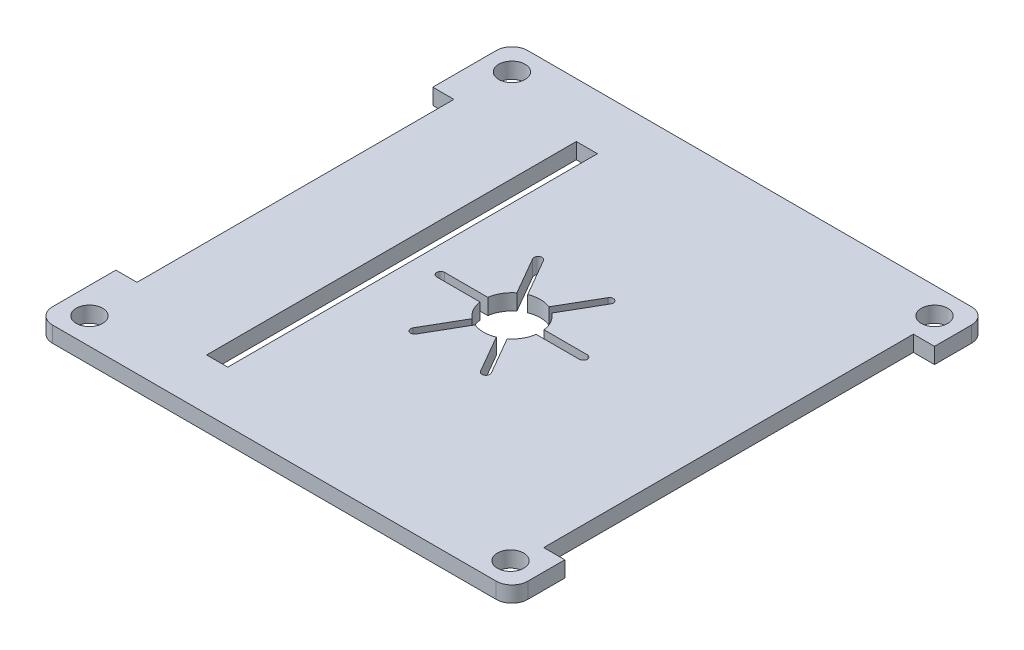
from build123d import *

# Parameters (mm, degrees)
SKETCH1_W           = 4
SKETCH1_H           = 70
SKETCH1_H_2         = 60
BOSS_EXTRUDE1_DEPTH = 3
SKETCH1_3_W         = 4
SKETCH1_3_H         = 60
SKETCH1_3_H_2       = 70
BOSS_EXTRUDE2_DEPTH = 70
SKETCH1_4_W         = 4
SKETCH1_4_H         = 70
BOSS_EXTRUDE3_DEPTH = 70
SKETCH5_R           = 4
CUT_EXTRUDE4_DEPTH  = 10
SKETCH6_R           = 2.5
CUT_EXTRUDE5_DEPTH  = 10
SKETCH1_5_W         = 4
SKETCH1_5_H         = 60
BOSS_EXTRUDE4_DEPTH = 80
SKETCH5_2_R         = 4
CUT_EXTRUDE6_DEPTH  = 10
FILLET1_R           = 3
FILLET2_R           = 5
FILLET3_R           = 4
SKETCH7_R           = 2.5
CUT_EXTRUDE7_DEPTH  = 10
SKETCH8_R           = 2.5
CUT_EXTRUDE8_DEPTH  = 10
CUT_EXTRUDE9_REACH  = 132.084
SKETCH9_R           = 3.5
SKETCH26_R          = 2.5
CUT_EXTRUDE11_DEPTH = 10
CUT_EXTRUDE14_DEPTH = 10
CUT_EXTRUDE15_DEPTH = 10
SKETCH28_R          = 1
SKETCH28_R_2        = 4
CUT_EXTRUDE16_DEPTH = 4
SKETCH29_R          = 1
SKETCH29_R_2        = 3.5
CUT_EXTRUDE18_DEPTH = 4
SKETCH31_R          = 5.375
CUT_EXTRUDE19_DEPTH = 10
SKETCH32_W          = 71.641660037
SKETCH32_H          = 79.51751689
CUT_EXTRUDE20_DEPTH = 131.084107183
SKETCH33_W          = 4
SKETCH33_H          = 70
SKETCH33_H_2        = 60
CUT_EXTRUDE21_DEPTH = 71.771465692


with BuildPart() as part:
    # Sketch1 → Boss-Extrude1 (new body)
    # profile 1 of 4: a face of its own
    with BuildSketch(Plane(origin=(0, 0, 0), x_dir=(1, 0, 0), z_dir=(0, 1, 0))):
        Polygon((-50.771305032, 49.212548619), (-50.771305032, 34.212548619), (-46.771305032, 34.212548619), (-46.771305032, -25.787451381), (-50.771305032, -25.787451381), (-50.771305032, -40.787451381), (39.228694968, -40.787451381), (39.228694968, -30.787451381), (35.228694968, -30.787451381), (35.228694968, 39.212548619), (39.228694968, 39.212548619), (39.228694968, 49.212548619), align=None)
        with Locations((-26.271305032, 3.893815937)):
            Rectangle(SKETCH1_W, SKETCH1_H, mode=Mode.SUBTRACT)
    # profile 2 of 4: a face of its own
    with BuildSketch(Plane(origin=(0, 0, 0), x_dir=(1, 0, 0), z_dir=(0, 1, 0))):
        with Locations((37.228694968, 4.212548619)):
            Rectangle(SKETCH1_W, SKETCH1_H)
    # profile 3 of 4: a face of its own
    with BuildSketch(Plane(origin=(0, 0, 0), x_dir=(1, 0, 0), z_dir=(0, 1, 0))):
        with Locations((-48.771305032, 4.212548619)):
            Rectangle(SKETCH1_W, SKETCH1_H_2)
    # profile 4 of 4: a face of its own
    with BuildSketch(Plane(origin=(0, 0, 0), x_dir=(1, 0, 0), z_dir=(0, 1, 0))):
        with Locations((-26.271305032, 3.893815937)):
            Rectangle(SKETCH1_W, SKETCH1_H)
    extrude(amount=BOSS_EXTRUDE1_DEPTH)

    # Sketch1<3> → Boss-Extrude2 (add)
    with BuildSketch(Plane(origin=(0, 0, 0), x_dir=(1, 0, 0), z_dir=(0, 1, 0))):
        with Locations((-48.771305032, 4.212548619)):
            Rectangle(SKETCH1_3_W, SKETCH1_3_H)
        with Locations((37.228694968, 4.212548619)):
            Rectangle(SKETCH1_3_W, SKETCH1_3_H_2)
    extrude(amount=BOSS_EXTRUDE2_DEPTH)

    # Sketch1<4> → Boss-Extrude3 (add)
    with BuildSketch(Plane(origin=(0, 0, 0), x_dir=(1, 0, 0), z_dir=(0, 1, 0))):
        with Locations((-26.271305032, 3.893815937)):
            Rectangle(SKETCH1_4_W, SKETCH1_4_H)
    extrude(amount=BOSS_EXTRUDE3_DEPTH)

    # Sketch5 → Cut-Extrude4 (cut)
    with BuildSketch(Plane.ZY.offset(50.771305032)):
        with Locations((-8.022548619, 60)):
            Circle(SKETCH5_R)
    extrude(amount=-CUT_EXTRUDE4_DEPTH, mode=Mode.SUBTRACT)

    # Sketch6 → Cut-Extrude5 (cut)
    with BuildSketch(Plane(origin=(0, 3, 0), x_dir=(1, 0, 0), z_dir=(0, 1, 0))):
        with Locations(Location((-45.787574368, -35.787451381, 0), (0, 0, 270))):
            Circle(SKETCH6_R)
        with Locations(Location((-45.787574368, 44.212548619, 0), (0, 0, 270))):
            Circle(SKETCH6_R)
        with Locations((43.718511914, 44.212548619)):
            Circle(SKETCH6_R)
        with Locations((43.718511914, -35.787451381)):
            Circle(SKETCH6_R)
    extrude(amount=-CUT_EXTRUDE5_DEPTH, mode=Mode.SUBTRACT)

    # Sketch1<5> → Boss-Extrude4 (add)
    with BuildSketch(Plane(origin=(0, 0, 0), x_dir=(1, 0, 0), z_dir=(0, 1, 0))):
        with Locations((-48.771305032, 4.212548619)):
            Rectangle(SKETCH1_5_W, SKETCH1_5_H)
    extrude(amount=BOSS_EXTRUDE4_DEPTH)

    # Sketch5<2> → Cut-Extrude6 (cut)
    with BuildSketch(Plane.ZY.offset(50.771305032)):
        with Locations((-8.022548619, 60)):
            Circle(SKETCH5_2_R)
    extrude(amount=-CUT_EXTRUDE6_DEPTH, mode=Mode.SUBTRACT)

    # Fillet1
    fillet1_edges = [part.edges().sort_by_distance(p)[0] for p in [
        (-50.771305032, 1.5, 40.787451381),
        (-50.771305032, 1.5, -49.212548619),
        (39.228694968, 1.5, -49.212548619),
        (39.228694968, 1.5, 40.787451381),
    ]]
    fillet(fillet1_edges, radius=FILLET1_R)

    # Fillet2
    fillet2_edges = [part.edges().sort_by_distance(p)[0] for p in [
        (-48.771305032, 80, -34.212548619),
        (-48.771305032, 80, 25.787451381),
        (37.228694968, 70, -39.212548619),
        (37.228694968, 70, 30.787451381),
    ]]
    fillet(fillet2_edges, radius=FILLET2_R)

    # Fillet3
    fillet3_edges = [part.edges().sort_by_distance(p)[0] for p in [
        (-26.271305032, 70, 31.106184063),
        (-26.271305032, 70, -38.893815937),
    ]]
    fillet(fillet3_edges, radius=FILLET3_R)

    # Sketch7 → Cut-Extrude7 (cut)
    with BuildSketch(Plane(origin=(39.228694968, 0, 0), x_dir=(0, 0, -1), z_dir=(1, 0, 0))):
        with Locations((27.482306935, -10)):
            Circle(SKETCH7_R)
    extrude(amount=-CUT_EXTRUDE7_DEPTH, mode=Mode.SUBTRACT)

    # Sketch8 → Cut-Extrude8 (cut)
    with BuildSketch(Plane(origin=(39.228694968, 0, 0), x_dir=(0, 0, -1), z_dir=(1, 0, 0))):
        with Locations((8.02072759, 38.893893193)):
            Circle(SKETCH8_R)
    extrude(amount=-CUT_EXTRUDE8_DEPTH, mode=Mode.SUBTRACT)

    # Cut-Extrude9: up to this face of the body (flat: up to its plane)
    cut_extrude9_end = Plane(part.part.faces().sort_by_distance((-28.271305032, 36.452186393, -3.893815937))[0])
    # Sketch9 → Cut-Extrude9 (cut, up to the picked face)
    with BuildSketch(Plane(origin=(39.228694968, 0, 0), x_dir=(0, 0, -1), z_dir=(1, 0, 0)), mode=Mode.PRIVATE) as cut_extrude9_sk1:
        with Locations((8.02072759, 38.893893193)):
            Circle(SKETCH9_R)
    cut_extrude9_tool1 = split(extrude(cut_extrude9_sk1.sketch, amount=-CUT_EXTRUDE9_REACH, mode=Mode.PRIVATE), bisect_by=cut_extrude9_end, keep=Keep.BOTH, mode=Mode.PRIVATE)
    add(cut_extrude9_tool1.solids().sort_by(Axis((39.228695, 38.893893, -8.020728), (-1, 0, 0)))[0], mode=Mode.SUBTRACT)

    # Sketch26 → Cut-Extrude11 (cut)
    with BuildSketch(Plane(origin=(0, 3, 0), x_dir=(1, 0, 0), z_dir=(0, 1, 0))):
        with Locations(Location((34.228694968, -36.063353705, 0), (0, 0, 270))):
            Circle(SKETCH26_R)
        with Locations(Location((34.228694968, 44.212548619, 0), (0, 0, 270))):
            Circle(SKETCH26_R)
    extrude(amount=-CUT_EXTRUDE11_DEPTH, mode=Mode.SUBTRACT)

    # Sketch27 → Cut-Extrude14 (cut)
    with BuildSketch(Plane(origin=(0, 3, 0), x_dir=(1, 0, 0), z_dir=(0, 1, 0))):
        with BuildLine():
            Line((7.728694968, 3.462548619), (-19.271305032, 3.462548619))
            ThreePointArc((-19.271305032, 3.462548619), (-20.021305032, 4.212548619), (-19.271305032, 4.962548619))
            Line((-19.271305032, 4.962548619), (7.728694968, 4.962548619))
            ThreePointArc((7.728694968, 4.962548619), (8.478694968, 4.212548619), (7.728694968, 3.462548619))
        make_face()
        with BuildLine():
            Line((0.329175915, -7.853794332), (-13.170824085, 15.52889157))
            ThreePointArc((-13.170824085, 15.52889157), (-12.896305032, 16.553410623), (-11.871785979, 16.27889157))
            Line((-11.871785979, 16.27889157), (1.628214021, -7.103794332))
            ThreePointArc((1.628214021, -7.103794332), (1.353694968, -8.128313385), (0.329175915, -7.853794332))
        make_face()
        with BuildLine():
            Line((-13.170824085, -7.103794332), (0.329175915, 16.27889157))
            ThreePointArc((0.329175915, 16.27889157), (1.353694968, 16.553410623), (1.628214021, 15.52889157))
            Line((1.628214021, 15.52889157), (-11.871785979, -7.853794332))
            ThreePointArc((-11.871785979, -7.853794332), (-12.896305032, -8.128313385), (-13.170824085, -7.103794332))
        make_face()
    extrude(amount=-CUT_EXTRUDE14_DEPTH, mode=Mode.SUBTRACT)

    # Sketch27<7> → Cut-Extrude15 (cut)
    with BuildSketch(Plane(origin=(0, 3, 0), x_dir=(1, 0, 0), z_dir=(0, 1, 0))):
        with BuildLine():
            Line((-7.743699741, 2.296260771), (-7.070343138, 3.462548619))
            Line((-7.070343138, 3.462548619), (-8.417056343, 3.462548619))
            ThreePointArc((-8.417056343, 3.462548619), (-8.152874893, 2.837548619), (-7.743699741, 2.296260771))
        make_face()
        with BuildLine():
            Line((-8.417056343, 4.962548619), (-7.070343138, 4.962548619))
            Line((-7.070343138, 4.962548619), (-7.743699741, 6.128836466))
            ThreePointArc((-7.743699741, 6.128836466), (-8.152874893, 5.587548619), (-8.417056343, 4.962548619))
        make_face()
        with BuildLine():
            Line((-5.771305032, 5.712548619), (-5.09794843, 6.878836466))
            ThreePointArc((-5.09794843, 6.878836466), (-5.771305032, 6.962548619), (-6.444661635, 6.878836466))
            Line((-6.444661635, 6.878836466), (-5.771305032, 5.712548619))
        make_face()
        with BuildLine():
            Line((-4.472266927, 4.962548619), (-3.125553721, 4.962548619))
            ThreePointArc((-3.125553721, 4.962548619), (-3.389735172, 5.587548619), (-3.798910324, 6.128836466))
            Line((-3.798910324, 6.128836466), (-4.472266927, 4.962548619))
        make_face()
        with BuildLine():
            ThreePointArc((-3.798910324, 2.296260771), (-3.389735172, 2.837548619), (-3.125553721, 3.462548619))
            Line((-3.125553721, 3.462548619), (-4.472266927, 3.462548619))
            Line((-4.472266927, 3.462548619), (-3.798910324, 2.296260771))
        make_face()
        with BuildLine():
            ThreePointArc((-6.444661635, 1.546260771), (-5.771305032, 1.462548619), (-5.09794843, 1.546260771))
            Line((-5.09794843, 1.546260771), (-5.771305032, 2.712548619))
            Line((-5.771305032, 2.712548619), (-6.444661635, 1.546260771))
        make_face()
    extrude(amount=-CUT_EXTRUDE15_DEPTH, mode=Mode.SUBTRACT)

    # Sketch28 → Cut-Extrude16 (cut)
    # profile 1 of 3: a face of its own
    with BuildSketch(Plane.ZY.offset(50.771305032)):
        with Locations((-2.316893756, 66.434710762)):
            Circle(SKETCH28_R)
    # profile 2 of 3: a face of its own
    with BuildSketch(Plane.ZY.offset(50.771305032)):
        with Locations((-20.69441, 45.708956331)):
            Circle(SKETCH28_R)
    # profile 3 of 3: a face of its own
    with BuildSketch(Plane.ZY.offset(50.771305032)):
        Polygon((-23.458777666, 51.635023443), (-8.531192269, 68.470022529), (0.44747391, 60.508643651), (-14.480111487, 43.673644564), align=None)
        with Locations((-8.022548619, 60)):
            Circle(SKETCH28_R_2, mode=Mode.SUBTRACT)
    extrude(amount=-CUT_EXTRUDE16_DEPTH, mode=Mode.SUBTRACT)

    # Sketch29 → Cut-Extrude18 (cut)
    # profile 1 of 3: a face of its own
    with BuildSketch(Plane(origin=(39.228694968, 0, 0), x_dir=(0, 0, -1), z_dir=(1, 0, 0))):
        with Locations((2.315072727, 45.328603955)):
            Circle(SKETCH29_R)
    # profile 2 of 3: a face of its own
    with BuildSketch(Plane(origin=(39.228694968, 0, 0), x_dir=(0, 0, -1), z_dir=(1, 0, 0))):
        with Locations((20.692588971, 24.602849525)):
            Circle(SKETCH29_R)
    # profile 3 of 3: a face of its own
    with BuildSketch(Plane(origin=(39.228694968, 0, 0), x_dir=(0, 0, -1), z_dir=(1, 0, 0))):
        Polygon((8.529371241, 47.363915722), (23.456956637, 30.528916636), (14.478290458, 22.567537758), (-0.449294939, 39.402536844), align=None)
        with Locations((8.02072759, 38.893893193)):
            Circle(SKETCH29_R_2, mode=Mode.SUBTRACT)
    extrude(amount=-CUT_EXTRUDE18_DEPTH, mode=Mode.SUBTRACT)

    # Sketch31 → Cut-Extrude19 (cut)
    with BuildSketch(Plane(origin=(0, 3, 0), x_dir=(1, 0, 0), z_dir=(0, 1, 0))):
        with Locations((-5.771305032, 4.212548619)):
            Circle(SKETCH31_R)
    extrude(amount=-CUT_EXTRUDE19_DEPTH, mode=Mode.SUBTRACT)

    # Sketch32 → Cut-Extrude20 (cut, through all)
    with BuildSketch(Plane(origin=(39.228694968, 0, 0), x_dir=(0, 0, -1), z_dir=(1, 0, 0))):
        with Locations((4.714645955, 42.758758445)):
            Rectangle(SKETCH32_W, SKETCH32_H)
    extrude(amount=-CUT_EXTRUDE20_DEPTH, mode=Mode.SUBTRACT)

    # Sketch33 → Cut-Extrude21 (cut, through all)
    with BuildSketch(Plane(origin=(0, 3, 0), x_dir=(1, 0, 0), z_dir=(0, 1, 0))):
        with Locations((-26.271305032, 3.893815937)):
            Rectangle(SKETCH33_W, SKETCH33_H)
        with Locations((-48.771305032, 4.212548619)):
            Rectangle(SKETCH33_W, SKETCH33_H_2)
        with Locations((37.228694968, 4.212548619)):
            Rectangle(SKETCH33_W, SKETCH33_H)
    extrude(amount=-CUT_EXTRUDE21_DEPTH, mode=Mode.SUBTRACT)


solid = part.part
